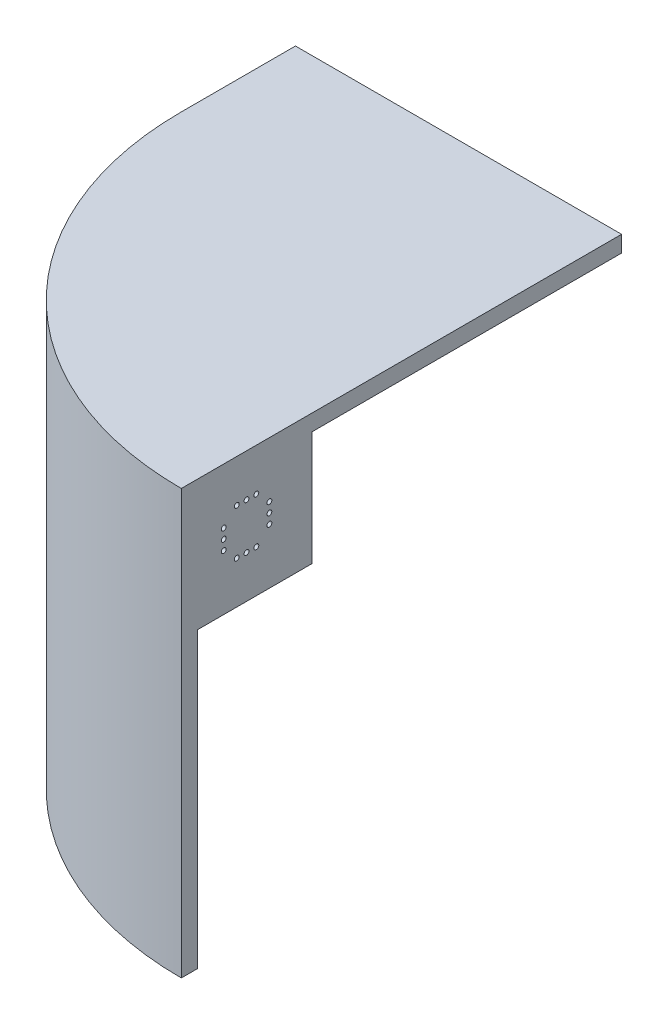
from build123d import *

# Parameters (mm, degrees)
BOSS_EXTRUDE1_DEPTH = 130
CUT_EXTRUDE1_DEPTH  = 125
SKETCH7_W           = 35
SKETCH7_H           = 35
BOSS_EXTRUDE3_DEPTH = 5
SKETCH8_R           = 0.75
CUT_EXTRUDE2_DEPTH  = 5


with BuildPart() as part:
    # Sketch2 → Boss-Extrude1 (new body)
    with BuildSketch(Plane(origin=(0, 0, 0), x_dir=(1, 0, 0), z_dir=(0, 1, 0))):
        with BuildLine():
            Line((0, -100), (0, 35))
            Line((0, 35), (-100, 35))
            Line((-100, 35), (-100, 0))
            ThreePointArc((-100, 0), (-70.710678119, -70.710678119), (0, -100))
        make_face()
    extrude(amount=BOSS_EXTRUDE1_DEPTH)

    # Sketch3 → Cut-Extrude1 (cut)
    with BuildSketch(Plane.XZ):
        with BuildLine():
            Line((0, 95), (0, -35))
            Line((0, -35), (-100, -35))
            Line((-100, -35), (-95, 0))
            ThreePointArc((-95, 0), (-67.175144213, 67.175144213), (0, 95))
        make_face()
    extrude(amount=-CUT_EXTRUDE1_DEPTH, mode=Mode.SUBTRACT)

    # Sketch7 → Boss-Extrude3 (add)
    with BuildSketch(Plane(origin=(0, 0, 0), x_dir=(0, 0, -1), z_dir=(1, 0, 0))):
        with Locations((-77.5, 107.5)):
            Rectangle(SKETCH7_W, SKETCH7_H)
    extrude(amount=-BOSS_EXTRUDE3_DEPTH)

    # Sketch8 → Cut-Extrude2 (cut)
    with BuildSketch(Plane(origin=(0, 0, 0), x_dir=(0, 0, -1), z_dir=(1, 0, 0))):
        with Locations((-87, 110)):
            Circle(SKETCH8_R)
        with Locations((-87, 107)):
            Circle(SKETCH8_R)
        with Locations((-87, 113)):
            Circle(SKETCH8_R)
        with Locations((-77, 117)):
            Circle(SKETCH8_R)
        with Locations((-80, 117)):
            Circle(SKETCH8_R)
        with Locations((-83, 117)):
            Circle(SKETCH8_R)
        with Locations((-73, 107)):
            Circle(SKETCH8_R)
        with Locations((-73, 110)):
            Circle(SKETCH8_R)
        with Locations((-73, 113)):
            Circle(SKETCH8_R)
        with Locations((-83, 103)):
            Circle(SKETCH8_R)
        with Locations((-80, 103)):
            Circle(SKETCH8_R)
        with Locations((-77, 103)):
            Circle(SKETCH8_R)
    extrude(amount=-CUT_EXTRUDE2_DEPTH, mode=Mode.SUBTRACT)


solid = part.part
